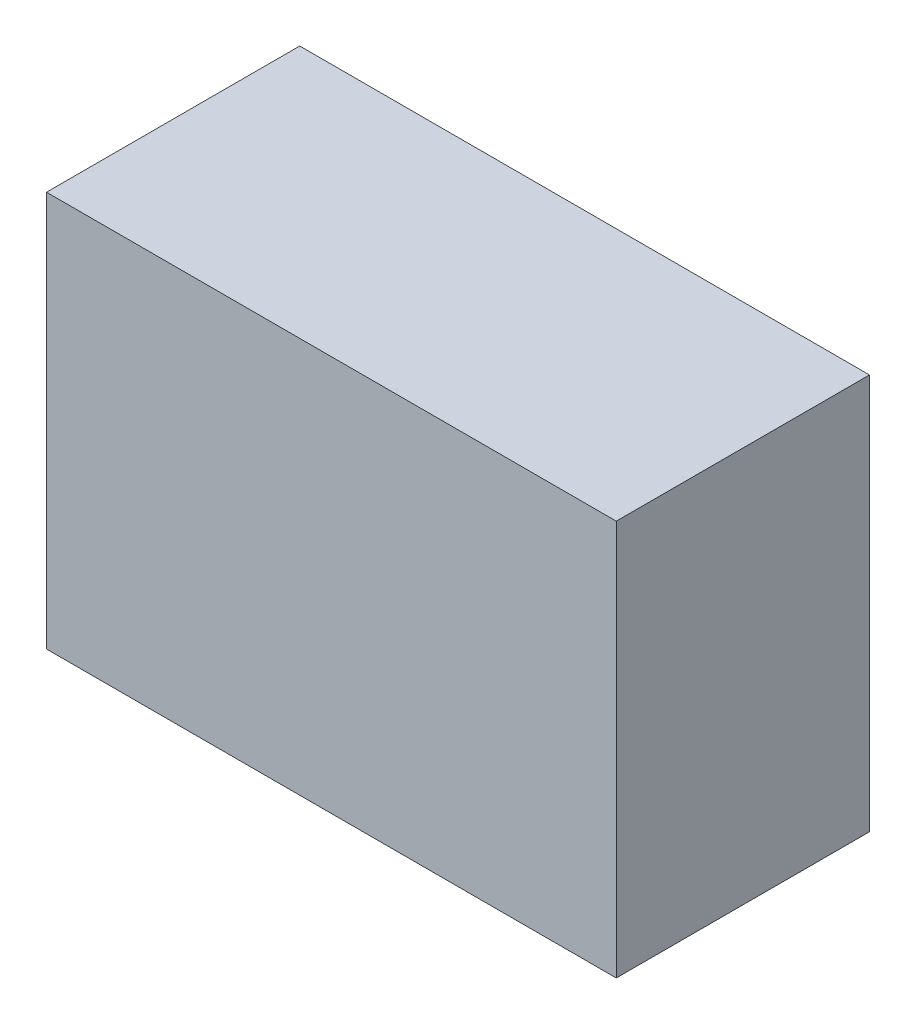
from build123d import *

# Parameters (mm, degrees)
SKETCH1_W           = 457.2
SKETCH1_H           = 317.5
BOSS_EXTRUDE1_DEPTH = 203.2


with BuildPart() as part:
    # Sketch1 → Boss-Extrude1 (new body)
    with BuildSketch(Plane.XY):
        with Locations((-634.571326192, -150.980519006)):
            Rectangle(SKETCH1_W, SKETCH1_H)
    extrude(amount=BOSS_EXTRUDE1_DEPTH)


solid = part.part
